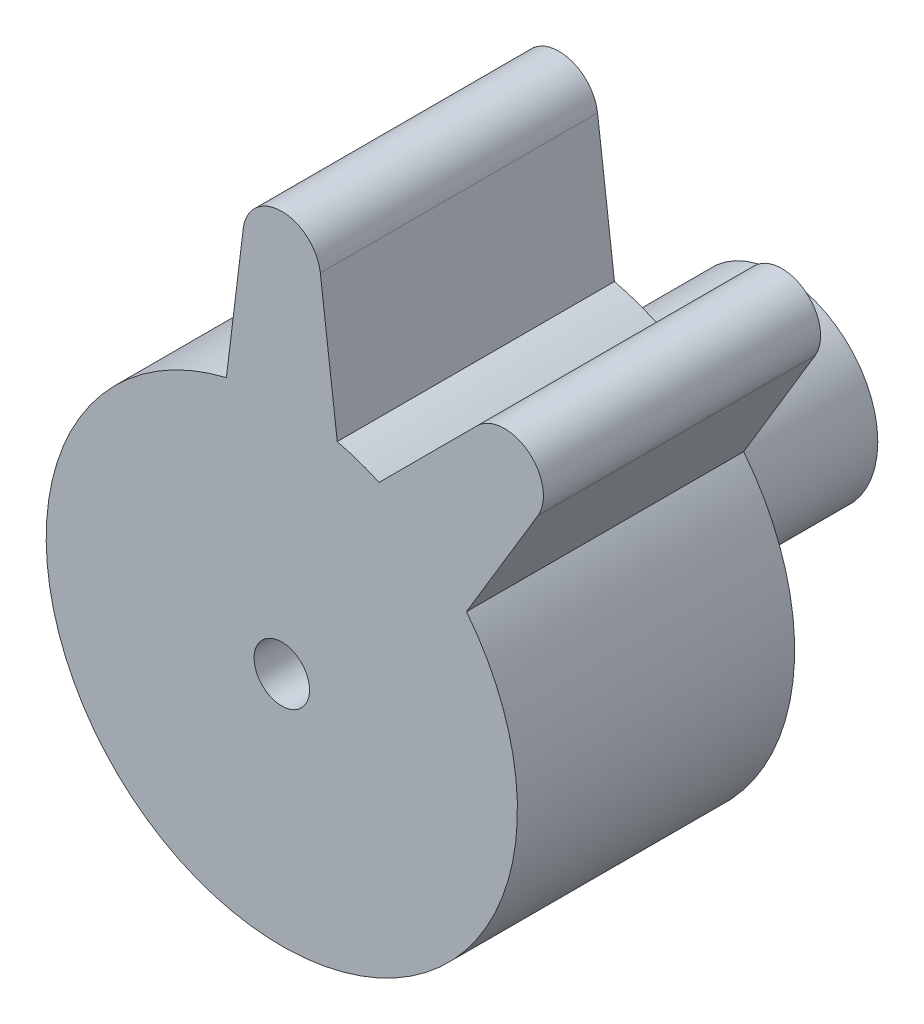
from build123d import *

# Parameters (mm, degrees)
SKETCH1_R               = 1
BOSS_EXTRUDE1_DEPTH     = 10
SKETCH5_R               = 3.5
SKETCH5_R_2             = 2
BOSS_EXTRUDE3_DEPTH     = 8
CUT_EXTRUDE1_DEPTH      = 20.949878445
CUT_EXTRUDE1_DEPTH_BACK = 20.949878445
SKETCH6_R               = 1


with BuildPart() as part:
    # Sketch1 → Boss-Extrude1 (new body)
    with BuildSketch(Plane.XY):
        with BuildLine():
            Line((-1.390653283, 13.224086579), (-2, 8.261355821))
            ThreePointArc((-2, 8.261355821), (-2.767329313, -8.036907893), (6.66222002, 5.278714276))
            Line((6.66222002, 5.278714276), (9.237410395, 9.564550779))
            ThreePointArc((9.237410395, 9.564550779), (8.899037344, 11.390248383), (7.045710912, 11.276894083))
            Line((7.045710912, 11.276894083), (3.510177006, 7.741360177))
            ThreePointArc((3.510177006, 7.741360177), (2.767329313, 8.036907893), (2, 8.261355821))
            Line((2, 8.261355821), (1.390653283, 13.224086579))
            ThreePointArc((1.390653283, 13.224086579), (0, 14.454432673), (-1.390653283, 13.224086579))
        make_face()
        Circle(SKETCH1_R, mode=Mode.SUBTRACT)
    extrude(amount=BOSS_EXTRUDE1_DEPTH)

    # Sketch5 → Boss-Extrude3 (add)
    with BuildSketch(Plane(origin=(0, 0, 0), x_dir=(-1, 0, 0), z_dir=(0, 0, -1))):
        with Locations(Location((0, 0, 0), (0, 0, 180))):
            Circle(SKETCH5_R)
        Circle(SKETCH5_R_2, mode=Mode.SUBTRACT)
    extrude(amount=BOSS_EXTRUDE3_DEPTH)

    # Sketch6 → Cut-Extrude1 (cut, two sides: drawn at the far end of the back side and taken through both)
    with BuildSketch(Plane(origin=(0, 0, 0), x_dir=(0, 0, -1), z_dir=(1, 0, 0)).offset(-CUT_EXTRUDE1_DEPTH_BACK)):
        with Locations((2.5, 0)):
            Circle(SKETCH6_R)
    extrude(amount=CUT_EXTRUDE1_DEPTH + CUT_EXTRUDE1_DEPTH_BACK, mode=Mode.SUBTRACT)


solid = part.part
